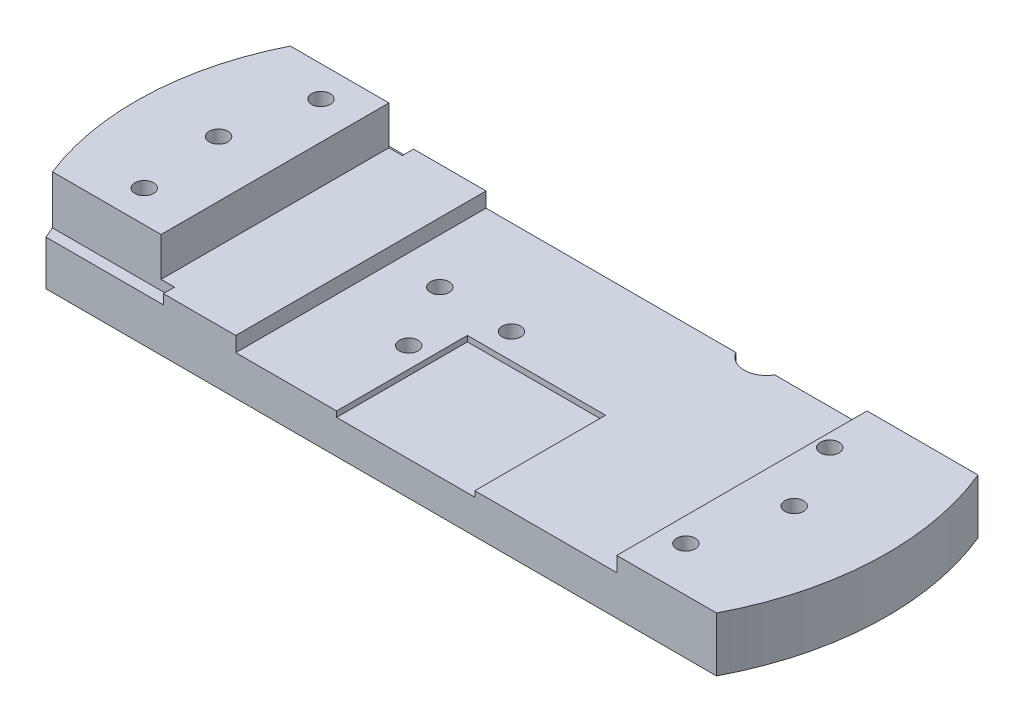
from build123d import *

# Parameters (mm, degrees)
SKETCH1_W           = 195
SKETCH1_H           = 67
BOSS_EXTRUDE1_DEPTH = 25
CUT_EXTRUDE1_DEPTH  = 107.082515053
CUT_EXTRUDE2_DEPTH  = 121.914225797
CUT_EXTRUDE3_START  = -13
SKETCH4_W           = 3.612655346
SKETCH4_H           = 3
CUT_EXTRUDE3_DEPTH  = 13
SKETCH6_R           = 2.5
CUT_EXTRUDE4_DEPTH  = 107.082515053
SKETCH7_W           = 37
SKETCH7_H           = 35
CUT_EXTRUDE5_DEPTH  = 1.5
CUT_EXTRUDE6_DEPTH  = 18.5


with BuildPart() as part:
    # Sketch1 → Boss-Extrude1 (new body)
    with BuildSketch(Plane(origin=(0, 0, 0), x_dir=(1, 0, 0), z_dir=(0, 1, 0))):
        Rectangle(SKETCH1_W, SKETCH1_H)
    extrude(amount=BOSS_EXTRUDE1_DEPTH)

    # Sketch2 → Cut-Extrude1 (cut, through all)
    with BuildSketch(Plane.XZ):
        with BuildLine():
            Line((97.5, -3.219751644), (97.5, 33.5))
            Line((97.5, 33.5), (88.5, 33.5))
            ThreePointArc((88.5, 33.5), (95.217186872, 15.683556008), (97.5, -3.219751644))
        make_face()
        with BuildLine():
            Line((97.5, -33.5), (97.5, -3.219751644))
            ThreePointArc((97.5, -3.219751644), (95.985558513, -18.65423771), (91.5, -33.5))
            Line((91.5, -33.5), (97.5, -33.5))
        make_face()
        with BuildLine():
            ThreePointArc((-88, -33.5), (-95.08607052, -15.861694529), (-97.5, 2.992884749))
            Line((-97.5, 2.992884749), (-97.5, -33.5))
            Line((-97.5, -33.5), (-88, -33.5))
        make_face()
        with BuildLine():
            ThreePointArc((-97.5, 2.992884749), (-95.856964648, 18.588830376), (-91, 33.5))
            Line((-91, 33.5), (-97.5, 33.5))
            Line((-97.5, 33.5), (-97.5, 2.992884749))
        make_face()
    extrude(amount=-CUT_EXTRUDE1_DEPTH, mode=Mode.SUBTRACT)

    # Sketch3 → Cut-Extrude2 (cut, through all)
    with BuildSketch(Plane(origin=(0, 0, 33.5), x_dir=(-1, 0, 0), z_dir=(0, 0, -1))):
        Polygon((63.2, 25), (63.2, 14.6), (40.2, 14.6), (40.2, 10.6), (-61.8, 10.6), (-61.8, 14.6), (-97.5, 14.6), (-97.5, 25), align=None)
    extrude(amount=CUT_EXTRUDE2_DEPTH, mode=Mode.SUBTRACT)

    # Sketch4 → Cut-Extrude3 (cut)
    with BuildSketch(Plane(origin=(0, 25, 0), x_dir=(1, 0, 0), z_dir=(0, 1, 0)).offset(CUT_EXTRUDE3_START)):
        with BuildLine():
            Line((-63.2, 30.5), (-63.2, 33.5))
            Line((-63.2, 33.5), (-88, 33.5))
            ThreePointArc((-88, 33.5), (-88.810680862, 32.008999469), (-89.587344654, 30.5))
            Line((-89.587344654, 30.5), (-63.2, 30.5))
        make_face()
        with Locations((-61.393672327, 32)):
            Rectangle(SKETCH4_W, SKETCH4_H)
        with BuildLine():
            Line((-63.2, -33.5), (-63.2, -30.5))
            Line((-63.2, -30.5), (-92.261692194, -30.5))
            ThreePointArc((-92.261692194, -30.5), (-91.647155152, -32.006859002), (-91, -33.5))
            Line((-91, -33.5), (-63.2, -33.5))
        make_face()
        with Locations((-61.393672327, -32)):
            Rectangle(SKETCH4_W, SKETCH4_H)
    extrude(amount=CUT_EXTRUDE3_DEPTH, mode=Mode.SUBTRACT)

    # Sketch6 → Cut-Extrude4 (cut, through all)
    with BuildSketch(Plane.XZ):
        with Locations(Location((-28.1, -9, 0), (0, 0, 270))):
            Circle(SKETCH6_R)
        with Locations(Location((-8.2, -8.3, 0), (0, 0, 270))):
            Circle(SKETCH6_R)
        with Locations(Location((-18.7, 8.7, 0), (0, 0, 270))):
            Circle(SKETCH6_R)
        with Locations(Location((-76.2, 22, 0), (0, 0, 270))):
            Circle(SKETCH6_R)
        with Locations(Location((-78.2, 0.1, 0), (0, 0, 270))):
            Circle(SKETCH6_R)
        with Locations(Location((-73.2, -22.3, 0), (0, 0, 270))):
            Circle(SKETCH6_R)
        with Locations(Location((65.3, -20, 0), (0, 0, 270))):
            Circle(SKETCH6_R)
        with Locations(Location((74.1, -1.7, 0), (0, 0, 270))):
            Circle(SKETCH6_R)
        with Locations(Location((68.3, 21.5, 0), (0, 0, 270))):
            Circle(SKETCH6_R)
    extrude(amount=-CUT_EXTRUDE4_DEPTH, mode=Mode.SUBTRACT)

    # Sketch7 → Cut-Extrude5 (cut)
    with BuildSketch(Plane(origin=(0, 10.6, 0), x_dir=(1, 0, 0), z_dir=(0, 1, 0))):
        with Locations((5.3, -16)):
            Rectangle(SKETCH7_W, SKETCH7_H)
    extrude(amount=-CUT_EXTRUDE5_DEPTH, mode=Mode.SUBTRACT)

    # Sketch8 → Cut-Extrude6 (cut)
    with BuildSketch(Plane(origin=(0, 25, 0), x_dir=(1, 0, 0), z_dir=(0, 1, 0))):
        with BuildLine():
            Line((37.096152423, 33.5), (31.9, 33.5))
            Line((31.9, 33.5), (31.9, 30.5))
            ThreePointArc((31.9, 30.5), (34.9, 31.303847577), (37.096152423, 33.5))
        make_face()
        with BuildLine():
            Line((31.9, 33.5), (26.703847577, 33.5))
            ThreePointArc((26.703847577, 33.5), (28.9, 31.303847577), (31.9, 30.5))
            Line((31.9, 30.5), (31.9, 33.5))
        make_face()
    extrude(amount=-CUT_EXTRUDE6_DEPTH, mode=Mode.SUBTRACT)


solid = part.part
